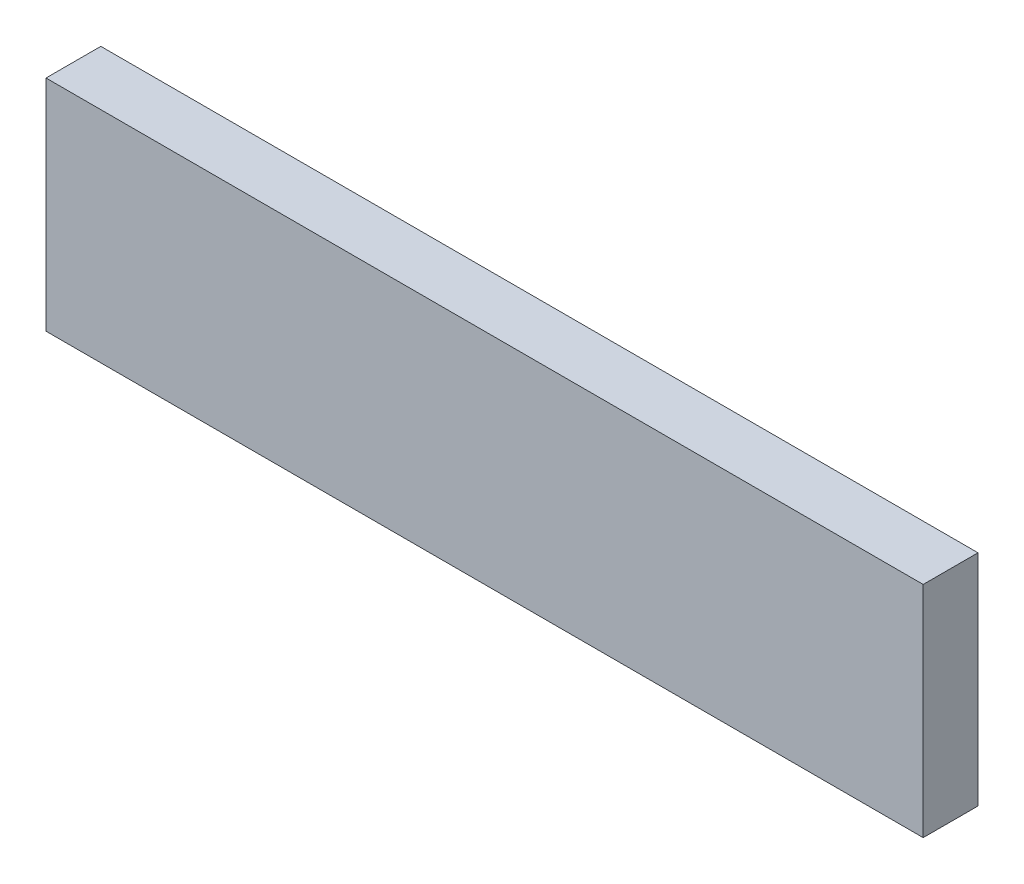
from build123d import *

# Parameters (mm, degrees)
SKETCH1_W           = 40
SKETCH1_H           = 10
BOSS_EXTRUDE1_DEPTH = 2.5


with BuildPart() as part:
    # Sketch1 → Boss-Extrude1 (new body)
    with BuildSketch(Plane.XY):
        with Locations((20, 5)):
            Rectangle(SKETCH1_W, SKETCH1_H)
    extrude(amount=BOSS_EXTRUDE1_DEPTH)


solid = part.part
